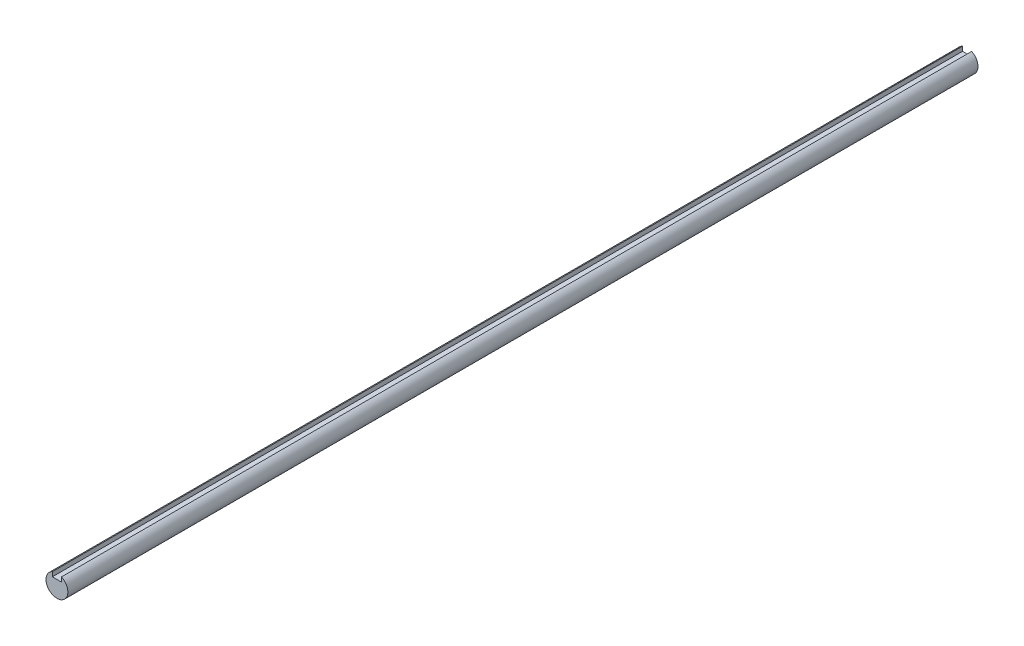
from build123d import *

# Parameters (mm, degrees)
SKETCH_1_R          = 6
EXTRUDE_1_DEPTH     = 250
CUT_EXTRUDE_1_DEPTH = 501.071994817


with BuildPart() as part:
    # 草图1 → 凸台-拉伸1 (new, symmetric)
    with BuildSketch(Plane.XY):
        Circle(SKETCH_1_R)
    extrude(amount=EXTRUDE_1_DEPTH, both=True)

    # 草图2 → 切除-拉伸1 (cut, through all)
    with BuildSketch(Plane.XY.offset(250)):
        with BuildLine():
            Line((2.5, 3), (-2.5, 3))
            Line((-2.5, 3), (-2.5, 5.454356057))
            ThreePointArc((-2.5, 5.454356057), (0, 6), (2.5, 5.454356057))
            Line((2.5, 5.454356057), (2.5, 3))
        make_face()
    extrude(amount=-CUT_EXTRUDE_1_DEPTH, mode=Mode.SUBTRACT)


solid = part.part
